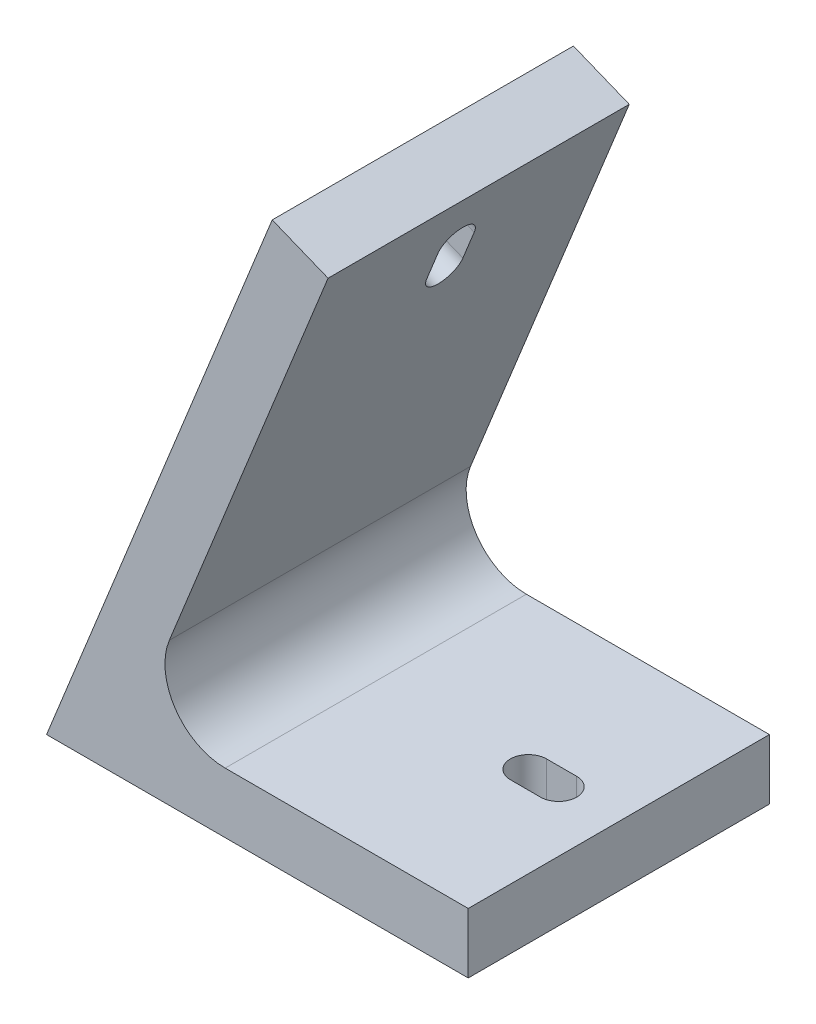
from build123d import *

# Parameters (mm, degrees)
BOSS_EXTRUDE1_DEPTH = 25
CUT_EXTRUDE1_DEPTH  = 112.208503688
CUT_EXTRUDE2_DEPTH  = 117.69747202
FILLET2_R           = 10


with BuildPart() as part:
    # Sketch1 → Boss-Extrude1 (new, symmetric)
    with BuildSketch(Plane.XY):
        Polygon((0, 0), (37.460659342, 92.718385457), (46.732497887, 88.972319523), (14.825609685, 10), (70, 10), (70, 0), align=None)
    extrude(amount=BOSS_EXTRUDE1_DEPTH, both=True)

    # Sketch2 → Cut-Extrude1 (cut, through all)
    with BuildSketch(Plane(origin=(0, 10, 0), x_dir=(1, 0, 0), z_dir=(0, 1, 0))):
        with BuildLine():
            Line((60, -3), (55, -3))
            ThreePointArc((55, -3), (52, 0), (55, 3))
            Line((55, 3), (60, 3))
            ThreePointArc((60, 3), (63, 0), (60, -3))
        make_face()
    extrude(amount=-CUT_EXTRUDE1_DEPTH, mode=Mode.SUBTRACT)

    # Sketch3 → Cut-Extrude2 (cut, through all)
    with BuildSketch(Plane(origin=(9.271838546, -3.746065934, 0), x_dir=(0, 0, -1), z_dir=(0.9271838545667856, -0.3746065934159163, 0))):
        with BuildLine():
            Line((3, 90), (3, 85))
            ThreePointArc((3, 85), (0, 82), (-3, 85))
            Line((-3, 85), (-3, 90))
            ThreePointArc((-3, 90), (0, 93), (3, 90))
        make_face()
    extrude(amount=-CUT_EXTRUDE2_DEPTH, mode=Mode.SUBTRACT)

    # Fillet2
    fillet2_edges = [part.edges().sort_by_distance(p)[0] for p in [
        (14.825609685, 10, 0),
    ]]
    fillet(fillet2_edges, radius=FILLET2_R)


solid = part.part
